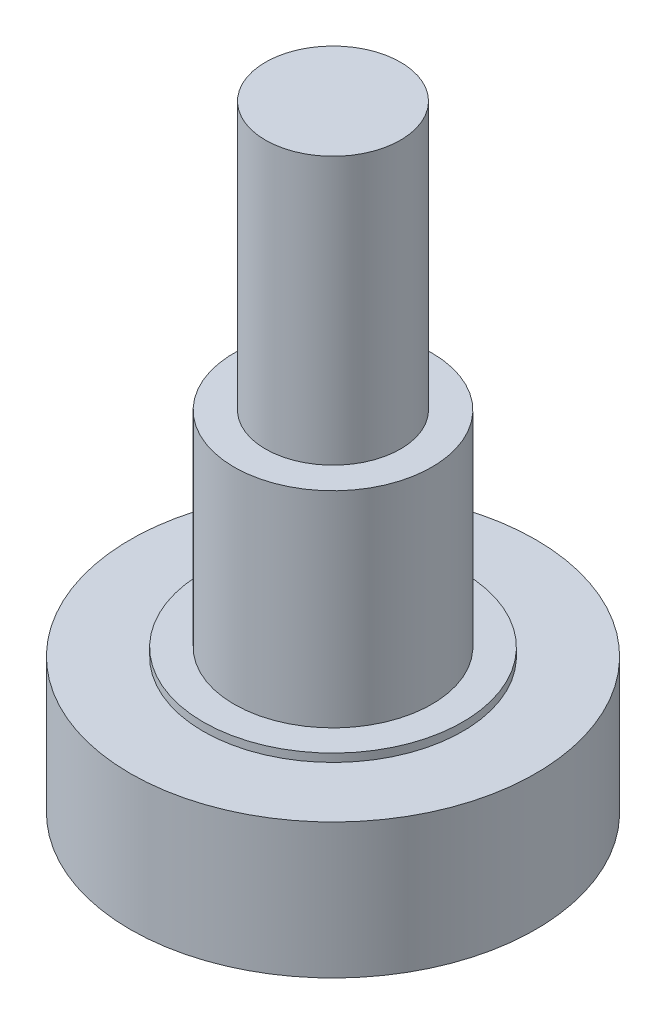
from build123d import *


with BuildPart() as part:
    # Sketch1 → Revolve1 (revolve)
    with BuildSketch(Plane.XY, mode=Mode.PRIVATE) as revolve1_sk:
        Polygon((0, 0), (-9.525, 0), (-9.525, 6.35), (-6.096, 6.35), (-6.096, 6.731), (-4.6482, 6.731), (-4.6482, 16.383), (-3.175, 16.383), (-3.175, 28.956), (0, 28.956), align=None)
    revolve(revolve1_sk.sketch.rotate(Axis((0, 0, 0), (0, -1, 0)), 270), axis=Axis((0, 0, 0), (0, -1, 0)))


solid = part.part
